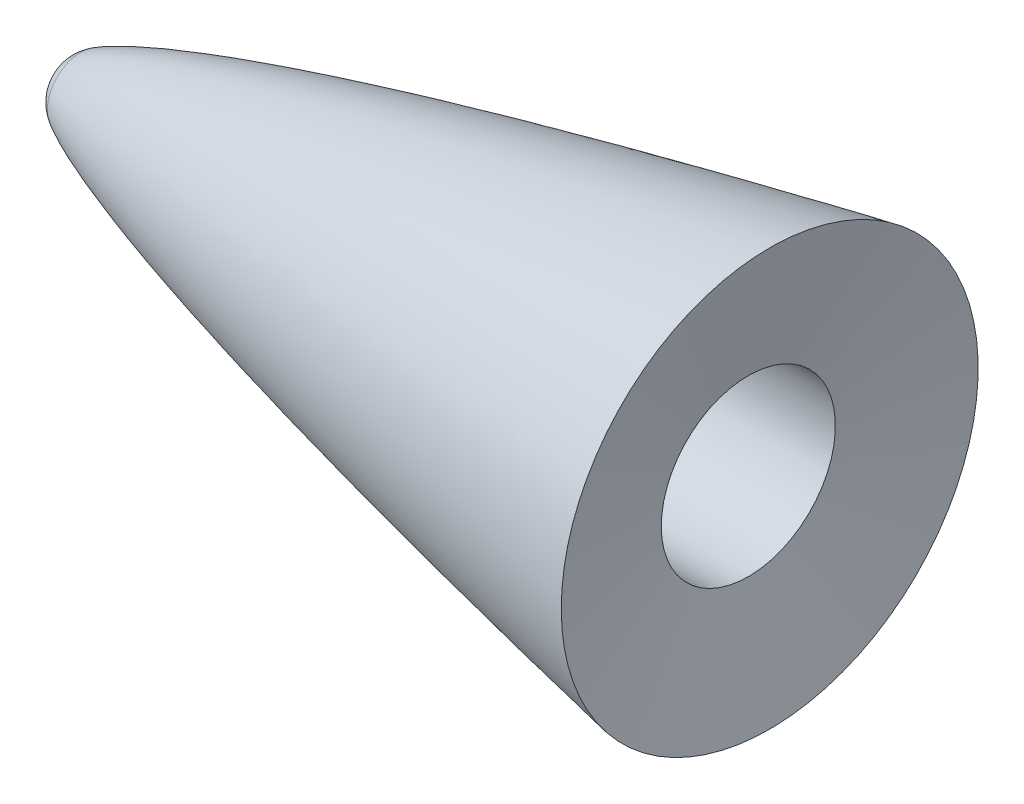
from build123d import *


with BuildPart() as part:
    # Sketch1 → Revolve1 (revolve)
    with BuildSketch(Plane.XY):
        with BuildLine():
            Line((33.908915079, 0), (-0.813304081, 0))
            ThreePointArc((-0.813304081, 0), (-0.447497983, 1.39742314), (0.556083667, 2.436379061))
            add(Edge.make_bspline(
                [(0.556083667, 2.436379061), (0.587417187, 2.455447316), (0.730047937, 2.54063648), (1.060600926, 2.723683459), (1.730307027, 3.053190151), (2.830074194, 3.527928934), (4.742769422, 4.258461085), (7.406572033, 5.151366902), (10.691861252, 6.141701799), (14.455458928, 7.183105108), (18.262220651, 8.168123108), (22.04504351, 9.098301543), (25.894890249, 10.001298738), (29.657767863, 10.854056209), (33.581423629, 11.709360696), (37.255812472, 12.491885628), (41.353700577, 13.334213197), (44.762260463, 14.024249725), (48.180356557, 14.694626674), (49.924215261, 15.033164301), (50.8, 15.2019)],
                knots=[0.012502878, 0.012502878, 0.012502878, 0.012502878, 0.012502878, 0.015039351, 0.023992138, 0.038642378, 0.064061249, 0.097932419, 0.165424269, 0.233166596, 0.300908919, 0.368651244, 0.436393569, 0.504135894, 0.571878221, 0.639620547, 0.707362872, 0.775105198, 0.842847524, 0.91058985, 0.91058985, 0.91058985, 0.91058985, 0.91058985], degree=4))
            Line((50.8, 15.2019), (49.2391712, 6.35))
            Line((49.2391712, 6.35), (36.5391712, 6.35))
            Line((36.5391712, 6.35), (33.908915079, 0))
        make_face()
    revolve(axis=Axis((0, 0, 0), (1, 0, 0)))


solid = part.part
